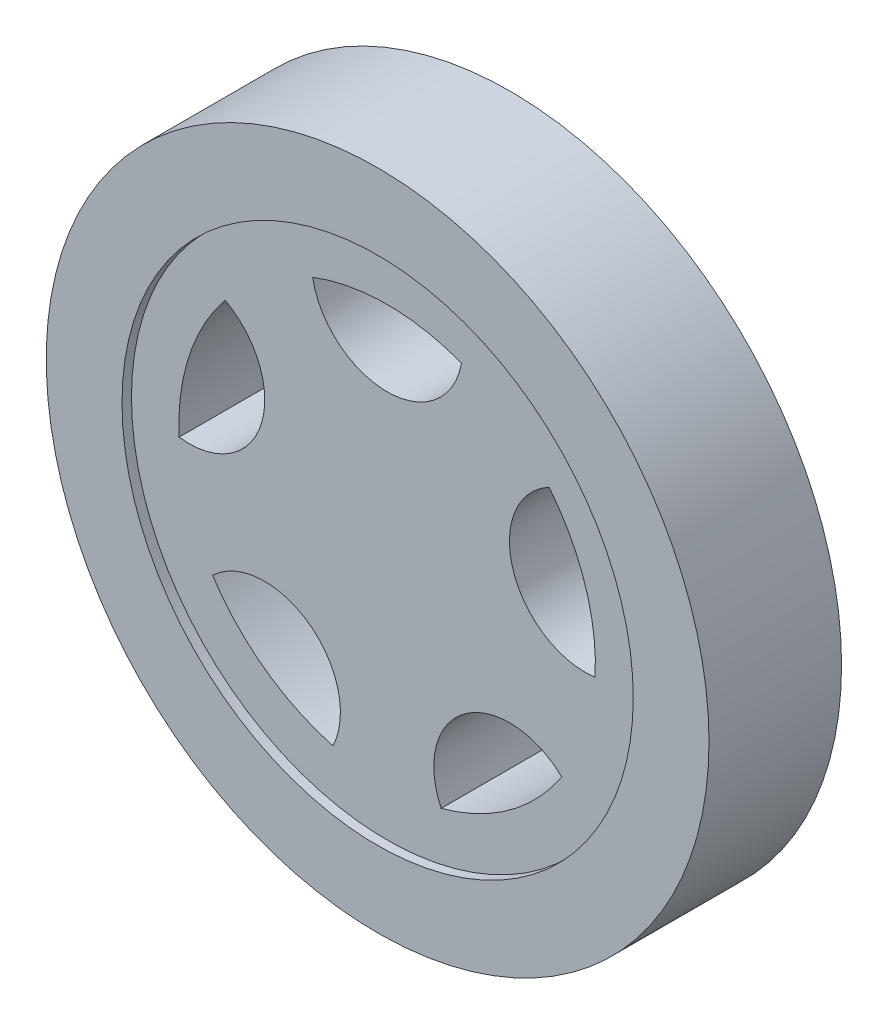
from build123d import *

# Parameters (mm, degrees)
EXTRUDE_1_DEPTH      = 35
EXTRUDE_1_DEPTH_BACK = 35
SKETCH_1_R           = 175
CUT_EXTRUDE_2_DEPTH  = 258.196422992
SKETCH_3_R           = 135
CUT_EXTRUDE_3_DEPTH  = 5
SKETCH_4_R           = 10
CUT_EXTRUDE_4_DEPTH  = 30


with BuildPart() as part:
    # 스케치1 → 보스-돌출1 (new, two sides: drawn at the far end of the back side and taken through both)
    with BuildSketch(Plane.XY.offset(-EXTRUDE_1_DEPTH_BACK)):
        Circle(SKETCH_1_R)
    extrude(amount=EXTRUDE_1_DEPTH + EXTRUDE_1_DEPTH_BACK)

    # 스케치2 → 컷-돌출2 (cut, through all)
    with BuildSketch(Plane.XY.offset(35)):
        with BuildLine():
            ThreePointArc((39.333286641, 102.727272727), (0, 110), (-39.333286641, 102.727272727))
            ThreePointArc((-39.333286641, 102.727272727), (0, 70), (39.333286641, 102.727272727))
        make_face()
        with BuildLine():
            ThreePointArc((-85.544788112, 69.152651626), (-104.616216792, 33.991869381), (-109.854096145, -5.663705509))
            ThreePointArc((-109.854096145, -5.663705509), (-66.573956141, 21.631189606), (-85.544788112, 69.152651626))
        make_face()
        with BuildLine():
            ThreePointArc((-92.202873255, -59.98858361), (-64.656377752, -88.991869381), (-28.56027858, -106.227635234))
            ThreePointArc((-28.56027858, -106.227635234), (-41.14496766, -56.631189606), (-92.202873255, -59.98858361))
        make_face()
        with BuildLine():
            ThreePointArc((28.56027858, -106.227635234), (64.656377752, -88.991869381), (92.202873255, -59.98858361))
            ThreePointArc((92.202873255, -59.98858361), (41.14496766, -56.631189606), (28.56027858, -106.227635234))
        make_face()
        with BuildLine():
            ThreePointArc((109.854096145, -5.663705509), (104.616216792, 33.991869381), (85.544788112, 69.152651626))
            ThreePointArc((85.544788112, 69.152651626), (66.573956141, 21.631189606), (109.854096145, -5.663705509))
        make_face()
    extrude(amount=-CUT_EXTRUDE_2_DEPTH, mode=Mode.SUBTRACT)

    # 스케치3 → 컷-돌출3 (cut)
    with BuildSketch(Plane.XY.offset(35)):
        Circle(SKETCH_3_R)
    cut_extrude_3 = extrude(amount=-CUT_EXTRUDE_3_DEPTH, mode=Mode.SUBTRACT)

    # 대칭 복사1: 컷-돌출3 across plane
    add(cut_extrude_3.mirror(Plane.XY), mode=Mode.SUBTRACT)

    # 스케치4 → 컷-돌출4 (cut)
    with BuildSketch(Plane(origin=(0, 0, -30), x_dir=(-1, 0, 0), z_dir=(0, 0, -1))):
        Circle(SKETCH_4_R)
    extrude(amount=-CUT_EXTRUDE_4_DEPTH, mode=Mode.SUBTRACT)


solid = part.part
